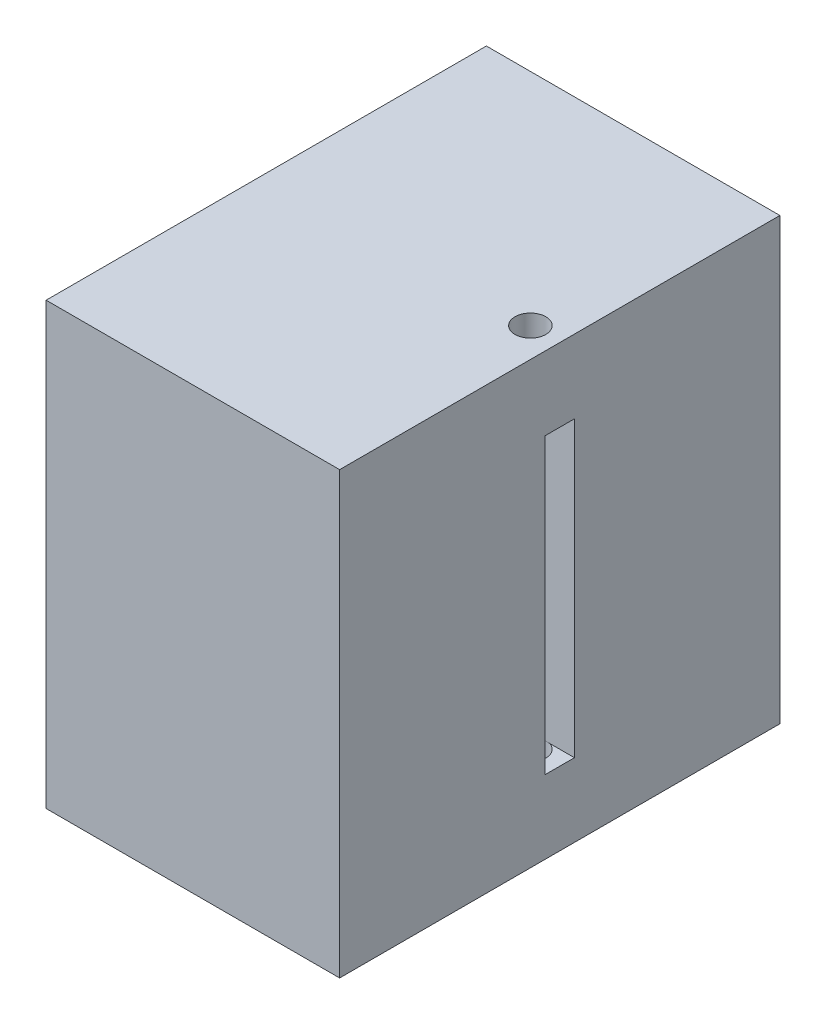
from build123d import *

# Parameters (mm, degrees)
SKETCH_2_W               = 20
SKETCH_2_H               = 30
EXTRUDE_3_DEPTH          = 30
SKETCH_4_W               = 8
SKETCH_4_H               = 2
CUT_EXTRUDE_1_DEPTH      = 20
CUT_EXTRUDE_6_DEPTH      = 67.759624542
CUT_EXTRUDE_6_DEPTH_BACK = 5
CUT_EXTRUDE_7_DEPTH      = 5


with BuildPart() as part:
    # 草图2 → 凸台-拉伸3 (new body)
    with BuildSketch(Plane.XY):
        with Locations((-41.544616295, 10.663270327)):
            Rectangle(SKETCH_2_W, SKETCH_2_H)
    extrude(amount=EXTRUDE_3_DEPTH)

    # 草图4 → 切除-拉伸1 (cut)
    with BuildSketch(Plane(origin=(0, 0.663270327, 0), x_dir=(-1, 0, 0), z_dir=(0, -1, 0))):
        with Locations((31.544616295, -15)):
            Rectangle(SKETCH_4_W, SKETCH_4_H)
    extrude(amount=-CUT_EXTRUDE_1_DEPTH, mode=Mode.SUBTRACT)

    # 草图5 → 切除-拉伸6 (cut, two sides: drawn at the far end of the back side and taken through both)
    with BuildSketch(Plane.XZ.offset(4.336729673).offset(-CUT_EXTRUDE_6_DEPTH_BACK)):
        with BuildLine():
            Line((-34.594616295, 15), (-32.494616295, 15))
            ThreePointArc((-32.494616295, 15), (-33.544616295, 16.05), (-34.594616295, 15))
        make_face()
        with BuildLine():
            Line((-33.864772507, 14), (-33.224460083, 14))
            ThreePointArc((-33.224460083, 14), (-32.696481865, 14.380994355), (-32.494616295, 15))
            Line((-32.494616295, 15), (-34.594616295, 15))
            ThreePointArc((-34.594616295, 15), (-34.392750725, 14.380994355), (-33.864772507, 14))
        make_face()
        with BuildLine():
            ThreePointArc((-33.864772507, 14), (-33.544616295, 13.95), (-33.224460083, 14))
            Line((-33.224460083, 14), (-33.864772507, 14))
        make_face()
    extrude(amount=CUT_EXTRUDE_6_DEPTH + CUT_EXTRUDE_6_DEPTH_BACK, mode=Mode.SUBTRACT)

    # 草图7 → 切除-拉伸7 (cut)
    with BuildSketch(Plane(origin=(0, 25.663270327, 0), x_dir=(1, 0, 0), z_dir=(0, 1, 0))):
        with BuildLine():
            ThreePointArc((-32.494616295, -15), (-33.544616295, -13.95), (-34.594616295, -15))
            Line((-34.594616295, -15), (-32.494616295, -15))
        make_face()
        with BuildLine():
            Line((-32.494616295, -15), (-34.594616295, -15))
            ThreePointArc((-34.594616295, -15), (-33.544616295, -16.05), (-32.494616295, -15))
        make_face()
    extrude(amount=-CUT_EXTRUDE_7_DEPTH, mode=Mode.SUBTRACT)


solid = part.part
